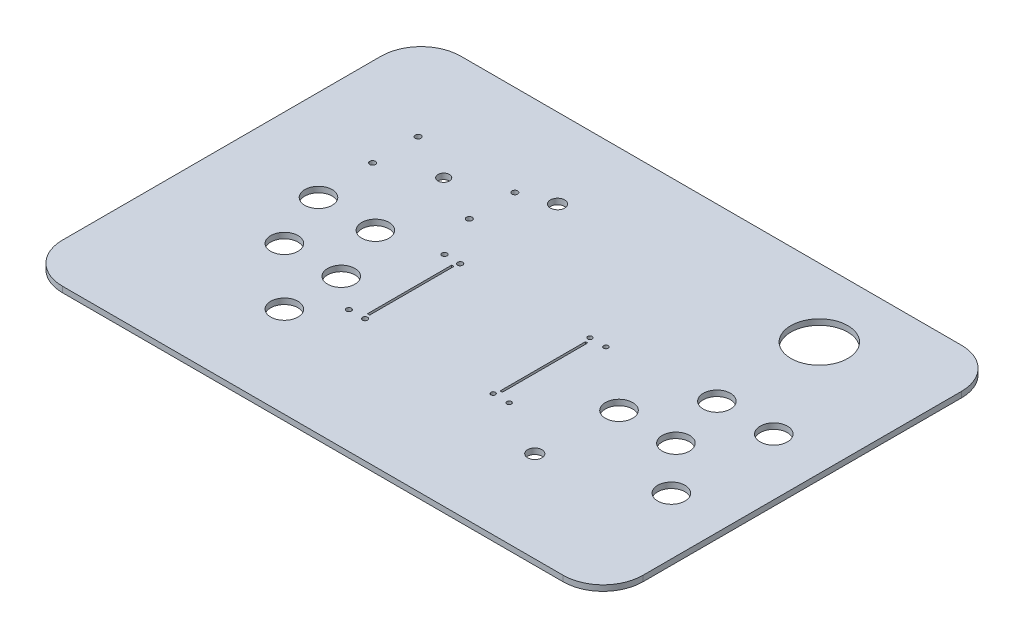
from build123d import *

# Parameters (mm, degrees)
SKETCH1_W               = 510
SKETCH1_H               = 350
BOSS_EXTRUDE1_DEPTH     = 5
SKETCH2_R               = 5
SKETCH2_R_2             = 2.5
F_1_JOYYSTICK_DEPTH     = 619.566892098
SKETCH3_R               = 12
F_1_BUTTONS_DEPTH       = 619.566892098
SKETCH4_R               = 6.25
F_1_ROCKET_SWITCH_DEPTH = 619.566892098
SKETCH5_R               = 2.25
SKETCH5_W               = 2
SKETCH5_H               = 74
F_1_POTENTIOMETER_DEPTH = 619.566892098
FILLET1_R               = 35
SKETCH6_R               = 12
F_2_BUTTONS_DEPTH       = 619.566892098
SKETCH9_R               = 25
F_2_SPEAKER_DEPTH       = 619.566892098
SKETCH10_R              = 6.25
F_2_ROCKET_SWITCH_DEPTH = 619.566892098
SKETCH8_R               = 2
SKETCH8_W               = 2
SKETCH8_H               = 75
F_2_POTENTIOMETER_DEPTH = 619.566892098


with BuildPart() as part:
    # Sketch1 → Boss-Extrude1 (new body)
    with BuildSketch(Plane(origin=(0, 0, 0), x_dir=(1, 0, 0), z_dir=(0, 1, 0))):
        with Locations((255, 175)):
            Rectangle(SKETCH1_W, SKETCH1_H)
    extrude(amount=BOSS_EXTRUDE1_DEPTH)

    # Sketch2 → 1 Joyystick (cut, through all)
    with BuildSketch(Plane(origin=(0, 5, 0), x_dir=(1, 0, 0), z_dir=(0, 1, 0))):
        with Locations((120, 250)):
            Circle(SKETCH2_R)
        with Locations((162.5, 270)):
            Circle(SKETCH2_R_2)
        with Locations((162.5, 230)):
            Circle(SKETCH2_R_2)
        with Locations((77.5, 230)):
            Circle(SKETCH2_R_2)
        with Locations((77.5, 270)):
            Circle(SKETCH2_R_2)
    extrude(amount=-F_1_JOYYSTICK_DEPTH, mode=Mode.SUBTRACT)

    # Sketch3 → 1 Buttons (cut, through all)
    with BuildSketch(Plane(origin=(0, 5, 0), x_dir=(1, 0, 0), z_dir=(0, 1, 0))):
        with Locations((80, 180)):
            Circle(SKETCH3_R)
        with Locations((130, 180)):
            Circle(SKETCH3_R)
        with Locations((100, 130)):
            Circle(SKETCH3_R)
        with Locations((150, 130)):
            Circle(SKETCH3_R)
        with Locations((150, 80)):
            Circle(SKETCH3_R)
    extrude(amount=-F_1_BUTTONS_DEPTH, mode=Mode.SUBTRACT)

    # Sketch4 → 1 Rocket Switch (cut, through all)
    with BuildSketch(Plane(origin=(0, 5, 0), x_dir=(1, 0, 0), z_dir=(0, 1, 0))):
        with Locations((190, 280)):
            Circle(SKETCH4_R)
    extrude(amount=-F_1_ROCKET_SWITCH_DEPTH, mode=Mode.SUBTRACT)

    # Sketch5 → 1 Potentiometer (cut, through all)
    with BuildSketch(Plane(origin=(0, 5, 0), x_dir=(1, 0, 0), z_dir=(0, 1, 0))):
        with Locations((178.719749064, 192)):
            Circle(SKETCH5_R)
        with Locations((192.718338039, 191.801237073)):
            Circle(SKETCH5_R)
        with Locations((192.718338039, 108.198762927)):
            Circle(SKETCH5_R)
        with Locations((178.719749064, 108)):
            Circle(SKETCH5_R)
        with Locations((191, 150)):
            Rectangle(SKETCH5_W, SKETCH5_H)
    extrude(amount=-F_1_POTENTIOMETER_DEPTH, mode=Mode.SUBTRACT)

    # Fillet1
    fillet1_edges = [part.edges().sort_by_distance(p)[0] for p in [
        (0, 2.5, 0),
        (510, 2.5, 0),
        (510, 2.5, -350),
        (0, 2.5, -350),
    ]]
    fillet(fillet1_edges, radius=FILLET1_R)

    # Sketch6 → 2 Buttons (cut, through all)
    with BuildSketch(Plane(origin=(0, 5, 0), x_dir=(1, 0, 0), z_dir=(0, 1, 0))):
        with Locations((460, 200)):
            Circle(SKETCH6_R)
        with Locations((410, 200)):
            Circle(SKETCH6_R)
        with Locations((424.025675508, 150)):
            Circle(SKETCH6_R)
        with Locations((374.025675508, 150)):
            Circle(SKETCH6_R)
        with Locations((460, 110)):
            Circle(SKETCH6_R)
    extrude(amount=-F_2_BUTTONS_DEPTH, mode=Mode.SUBTRACT)

    # Sketch9 → 2 speaker (cut, through all)
    with BuildSketch(Plane(origin=(0, 5, 0), x_dir=(1, 0, 0), z_dir=(0, 1, 0))):
        with Locations((410, 290)):
            Circle(SKETCH9_R)
    extrude(amount=-F_2_SPEAKER_DEPTH, mode=Mode.SUBTRACT)

    # Sketch10 → 2 Rocket Switch (cut, through all)
    with BuildSketch(Plane(origin=(0, 5, 0), x_dir=(1, 0, 0), z_dir=(0, 1, 0))):
        with Locations((370, 80)):
            Circle(SKETCH10_R)
    extrude(amount=-F_2_ROCKET_SWITCH_DEPTH, mode=Mode.SUBTRACT)

    # Sketch8 → 2 Potentiometer (cut, through all)
    with BuildSketch(Plane(origin=(0, 5, 0), x_dir=(1, 0, 0), z_dir=(0, 1, 0))):
        with Locations((320, 192.5)):
            Circle(SKETCH8_R)
        with Locations((320, 107.5)):
            Circle(SKETCH8_R)
        with Locations((306, 107.5)):
            Circle(SKETCH8_R)
        with Locations((306, 192.5)):
            Circle(SKETCH8_R)
        with Locations((308, 150)):
            Rectangle(SKETCH8_W, SKETCH8_H)
    extrude(amount=-F_2_POTENTIOMETER_DEPTH, mode=Mode.SUBTRACT)


solid = part.part
